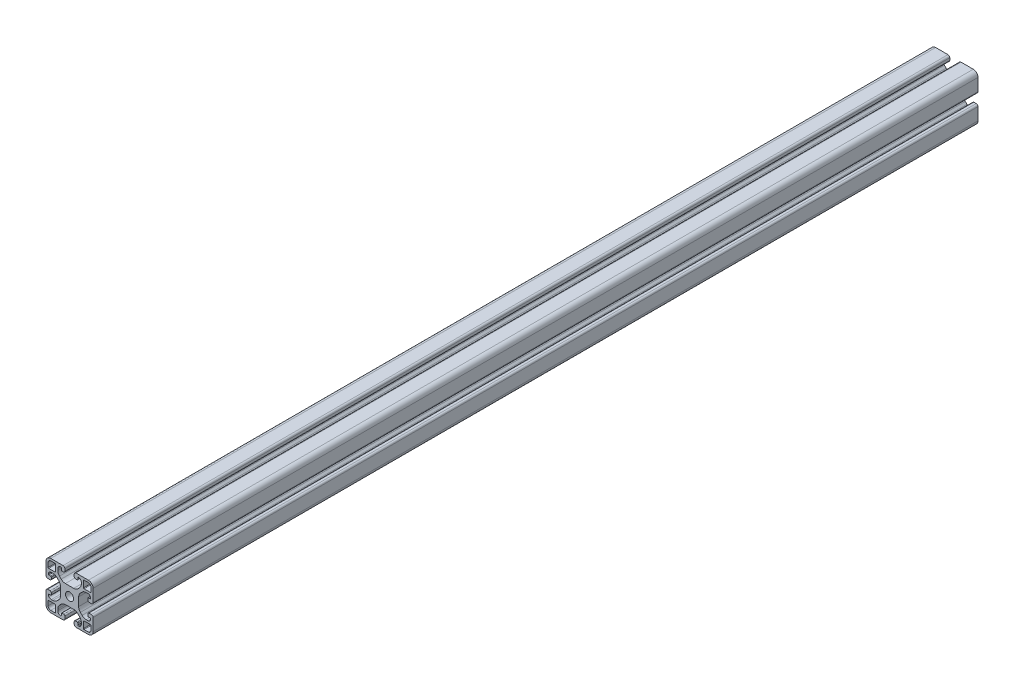
from build123d import *

# Parameters (mm, degrees)
ESQUISSE1_R        = 3.4
BOSS_EXTRU_1_DEPTH = 752


with BuildPart() as part:
    # Esquisse1 → Boss.-Extru.1 (new body)
    with BuildSketch(Plane(origin=(0, 0, -30), x_dir=(-1, 0, 0), z_dir=(0, 0, -1))):
        with BuildLine():
            Line((-4.5, 15), (-4.5, 13.5))
            ThreePointArc((-4.5, 13.5), (-4.353553391, 13.146446609), (-4, 13))
            Line((-4, 13), (-2.5, 13))
            ThreePointArc((-2.5, 13), (-2.146446609, 12.853553391), (-2, 12.5))
            ThreePointArc((-2, 12.5), (-2.732233047, 10.732233047), (-4.5, 10))
            Line((-4.5, 10), (-5.807611845, 10))
            ThreePointArc((-5.807611845, 10), (-7.721029006, 10.380602337), (-9.343145751, 11.464466094))
            Line((-9.343145751, 11.464466094), (-10.785533906, 12.906854249))
            ThreePointArc((-10.785533906, 12.906854249), (-11.869397663, 14.528970994), (-12.25, 16.442388155))
            Line((-12.25, 16.442388155), (-12.25, 23.557611845))
            ThreePointArc((-12.25, 23.557611845), (-11.869397663, 25.471029006), (-10.785533906, 27.093145751))
            Line((-10.785533906, 27.093145751), (-9.343145751, 28.535533906))
            ThreePointArc((-9.343145751, 28.535533906), (-7.721029006, 29.619397663), (-5.807611845, 30))
            Line((-5.807611845, 30), (-4.5, 30))
            ThreePointArc((-4.5, 30), (-2.732233047, 29.267766953), (-2, 27.5))
            ThreePointArc((-2, 27.5), (-2.146446609, 27.146446609), (-2.5, 27))
            Line((-2.5, 27), (-4, 27))
            ThreePointArc((-4, 27), (-4.353553391, 26.853553391), (-4.5, 26.5))
            Line((-4.5, 26.5), (-4.5, 25))
            ThreePointArc((-4.5, 25), (-4.207106781, 24.292893219), (-3.5, 24))
            Line((-3.5, 24), (-1.5, 24))
            ThreePointArc((-1.5, 24), (-0.439339828, 24.439339828), (0, 25.5))
            Line((0, 25.5), (0, 36))
            ThreePointArc((0, 36), (-1.171572875, 38.828427125), (-4, 40))
            Line((-4, 40), (-14.5, 40))
            ThreePointArc((-14.5, 40), (-15.560660172, 39.560660172), (-16, 38.5))
            Line((-16, 38.5), (-16, 36.5))
            ThreePointArc((-16, 36.5), (-15.707106781, 35.792893219), (-15, 35.5))
            Line((-15, 35.5), (-13.5, 35.5))
            ThreePointArc((-13.5, 35.5), (-13.146446609, 35.646446609), (-13, 36))
            Line((-13, 36), (-13, 37.5))
            ThreePointArc((-13, 37.5), (-12.853553391, 37.853553391), (-12.5, 38))
            ThreePointArc((-12.5, 38), (-10.732233047, 37.267766953), (-10, 35.5))
            Line((-10, 35.5), (-10, 34.192388155))
            ThreePointArc((-10, 34.192388155), (-10.380602337, 32.278970994), (-11.464466094, 30.656854249))
            Line((-11.464466094, 30.656854249), (-12.906854249, 29.214466094))
            ThreePointArc((-12.906854249, 29.214466094), (-14.528970994, 28.130602337), (-16.442388155, 27.75))
            Line((-16.442388155, 27.75), (-23.557611845, 27.75))
            ThreePointArc((-23.557611845, 27.75), (-25.471029006, 28.130602337), (-27.093145751, 29.214466094))
            Line((-27.093145751, 29.214466094), (-28.535533906, 30.656854249))
            ThreePointArc((-28.535533906, 30.656854249), (-29.619397663, 32.278970994), (-30, 34.192388155))
            Line((-30, 34.192388155), (-30, 35.5))
            ThreePointArc((-30, 35.5), (-29.267766953, 37.267766953), (-27.5, 38))
            ThreePointArc((-27.5, 38), (-27.146446609, 37.853553391), (-27, 37.5))
            Line((-27, 37.5), (-27, 36))
            ThreePointArc((-27, 36), (-26.853553391, 35.646446609), (-26.5, 35.5))
            Line((-26.5, 35.5), (-25, 35.5))
            ThreePointArc((-25, 35.5), (-24.292893219, 35.792893219), (-24, 36.5))
            Line((-24, 36.5), (-24, 38.5))
            ThreePointArc((-24, 38.5), (-24.439339828, 39.560660172), (-25.5, 40))
            Line((-25.5, 40), (-36, 40))
            ThreePointArc((-36, 40), (-38.828427125, 38.828427125), (-40, 36))
            Line((-40, 36), (-40, 25.5))
            ThreePointArc((-40, 25.5), (-39.560660172, 24.439339828), (-38.5, 24))
            Line((-38.5, 24), (-36.5, 24))
            ThreePointArc((-36.5, 24), (-35.792893219, 24.292893219), (-35.5, 25))
            Line((-35.5, 25), (-35.5, 26.5))
            ThreePointArc((-35.5, 26.5), (-35.646446609, 26.853553391), (-36, 27))
            Line((-36, 27), (-37.5, 27))
            ThreePointArc((-37.5, 27), (-37.853553391, 27.146446609), (-38, 27.5))
            ThreePointArc((-38, 27.5), (-37.267766953, 29.267766953), (-35.5, 30))
            Line((-35.5, 30), (-34.192388155, 30))
            ThreePointArc((-34.192388155, 30), (-32.278970994, 29.619397663), (-30.656854249, 28.535533906))
            Line((-30.656854249, 28.535533906), (-29.214466094, 27.093145751))
            ThreePointArc((-29.214466094, 27.093145751), (-28.130602337, 25.471029006), (-27.75, 23.557611845))
            Line((-27.75, 23.557611845), (-27.75, 16.442388155))
            ThreePointArc((-27.75, 16.442388155), (-28.130602337, 14.528970994), (-29.214466094, 12.906854249))
            Line((-29.214466094, 12.906854249), (-30.656854249, 11.464466094))
            ThreePointArc((-30.656854249, 11.464466094), (-32.278970994, 10.380602337), (-34.192388155, 10))
            Line((-34.192388155, 10), (-35.5, 10))
            ThreePointArc((-35.5, 10), (-37.267766953, 10.732233047), (-38, 12.5))
            ThreePointArc((-38, 12.5), (-37.853553391, 12.853553391), (-37.5, 13))
            Line((-37.5, 13), (-36, 13))
            ThreePointArc((-36, 13), (-35.646446609, 13.146446609), (-35.5, 13.5))
            Line((-35.5, 13.5), (-35.5, 15))
            ThreePointArc((-35.5, 15), (-35.792893219, 15.707106781), (-36.5, 16))
            Line((-36.5, 16), (-38.5, 16))
            ThreePointArc((-38.5, 16), (-39.560660172, 15.560660172), (-40, 14.5))
            Line((-40, 14.5), (-40, 4))
            ThreePointArc((-40, 4), (-38.828427125, 1.171572875), (-36, 0))
            Line((-36, 0), (-25.5, 0))
            ThreePointArc((-25.5, 0), (-24.439339828, 0.439339828), (-24, 1.5))
            Line((-24, 1.5), (-24, 3.5))
            ThreePointArc((-24, 3.5), (-24.292893219, 4.207106781), (-25, 4.5))
            Line((-25, 4.5), (-26.5, 4.5))
            ThreePointArc((-26.5, 4.5), (-26.853553391, 4.353553391), (-27, 4))
            Line((-27, 4), (-27, 2.5))
            ThreePointArc((-27, 2.5), (-27.146446609, 2.146446609), (-27.5, 2))
            ThreePointArc((-27.5, 2), (-29.267766953, 2.732233047), (-30, 4.5))
            Line((-30, 4.5), (-30, 5.807611845))
            ThreePointArc((-30, 5.807611845), (-29.619397663, 7.721029006), (-28.535533906, 9.343145751))
            Line((-28.535533906, 9.343145751), (-27.093145751, 10.785533906))
            ThreePointArc((-27.093145751, 10.785533906), (-25.471029006, 11.869397663), (-23.557611845, 12.25))
            Line((-23.557611845, 12.25), (-16.442388155, 12.25))
            ThreePointArc((-16.442388155, 12.25), (-14.528970994, 11.869397663), (-12.906854249, 10.785533906))
            Line((-12.906854249, 10.785533906), (-11.464466094, 9.343145751))
            ThreePointArc((-11.464466094, 9.343145751), (-10.380602337, 7.721029006), (-10, 5.807611845))
            Line((-10, 5.807611845), (-10, 4.5))
            ThreePointArc((-10, 4.5), (-10.732233047, 2.732233047), (-12.5, 2))
            ThreePointArc((-12.5, 2), (-12.853553391, 2.146446609), (-13, 2.5))
            Line((-13, 2.5), (-13, 4))
            ThreePointArc((-13, 4), (-13.146446609, 4.353553391), (-13.5, 4.5))
            Line((-13.5, 4.5), (-15, 4.5))
            ThreePointArc((-15, 4.5), (-15.707106781, 4.207106781), (-16, 3.5))
            Line((-16, 3.5), (-16, 1.5))
            ThreePointArc((-16, 1.5), (-15.560660172, 0.439339828), (-14.5, 0))
            Line((-14.5, 0), (-4, 0))
            ThreePointArc((-4, 0), (-1.171572875, 1.171572875), (0, 4))
            Line((0, 4), (0, 14.5))
            ThreePointArc((0, 14.5), (-0.439339828, 15.560660172), (-1.5, 16))
            Line((-1.5, 16), (-3.5, 16))
            ThreePointArc((-3.5, 16), (-4.207106781, 15.707106781), (-4.5, 15))
        make_face()
        with Locations(Location((-20, 20, 0), (0, 0, 180))):
            Circle(ESQUISSE1_R, mode=Mode.SUBTRACT)
        with BuildLine():
            Line((-4, 1.8), (-7.7, 1.8))
            ThreePointArc((-7.7, 1.8), (-8.053553391, 1.946446609), (-8.2, 2.3))
            Line((-8.2, 2.3), (-8.2, 7.7))
            ThreePointArc((-8.2, 7.7), (-8.053553391, 8.053553391), (-7.7, 8.2))
            Line((-7.7, 8.2), (-2.3, 8.2))
            ThreePointArc((-2.3, 8.2), (-1.946446609, 8.053553391), (-1.8, 7.7))
            Line((-1.8, 7.7), (-1.8, 4))
            ThreePointArc((-1.8, 4), (-2.444365081, 2.444365081), (-4, 1.8))
        make_face(mode=Mode.SUBTRACT)
        with BuildLine():
            Line((-38.2, 4), (-38.2, 7.7))
            ThreePointArc((-38.2, 7.7), (-38.053553391, 8.053553391), (-37.7, 8.2))
            Line((-37.7, 8.2), (-32.3, 8.2))
            ThreePointArc((-32.3, 8.2), (-31.946446609, 8.053553391), (-31.8, 7.7))
            Line((-31.8, 7.7), (-31.8, 2.3))
            ThreePointArc((-31.8, 2.3), (-31.946446609, 1.946446609), (-32.3, 1.8))
            Line((-32.3, 1.8), (-36, 1.8))
            ThreePointArc((-36, 1.8), (-37.555634919, 2.444365081), (-38.2, 4))
        make_face(mode=Mode.SUBTRACT)
        with BuildLine():
            Line((-36, 38.2), (-32.3, 38.2))
            ThreePointArc((-32.3, 38.2), (-31.946446609, 38.053553391), (-31.8, 37.7))
            Line((-31.8, 37.7), (-31.8, 32.3))
            ThreePointArc((-31.8, 32.3), (-31.946446609, 31.946446609), (-32.3, 31.8))
            Line((-32.3, 31.8), (-37.7, 31.8))
            ThreePointArc((-37.7, 31.8), (-38.053553391, 31.946446609), (-38.2, 32.3))
            Line((-38.2, 32.3), (-38.2, 36))
            ThreePointArc((-38.2, 36), (-37.555634919, 37.555634919), (-36, 38.2))
        make_face(mode=Mode.SUBTRACT)
        with BuildLine():
            Line((-1.8, 36), (-1.8, 32.3))
            ThreePointArc((-1.8, 32.3), (-1.946446609, 31.946446609), (-2.3, 31.8))
            Line((-2.3, 31.8), (-7.7, 31.8))
            ThreePointArc((-7.7, 31.8), (-8.053553391, 31.946446609), (-8.2, 32.3))
            Line((-8.2, 32.3), (-8.2, 37.7))
            ThreePointArc((-8.2, 37.7), (-8.053553391, 38.053553391), (-7.7, 38.2))
            Line((-7.7, 38.2), (-4, 38.2))
            ThreePointArc((-4, 38.2), (-2.444365081, 37.555634919), (-1.8, 36))
        make_face(mode=Mode.SUBTRACT)
    extrude(amount=-BOSS_EXTRU_1_DEPTH)


solid = part.part
